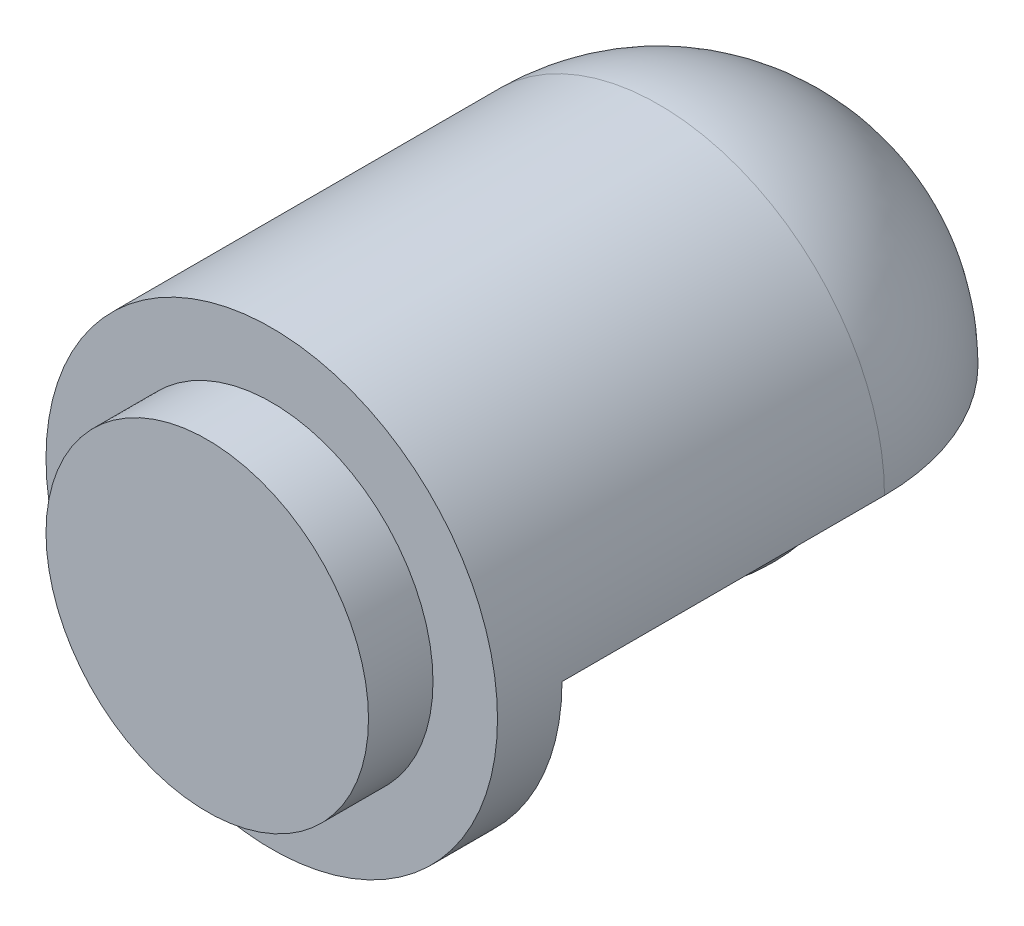
from build123d import *

# Parameters (mm, degrees)
SKETCH2_W           = 70
SKETCH2_H           = 120
REVOLVE2_ANGLE      = 180
SKETCH3_R           = 50
BOSS_EXTRUDE1_DEPTH = 20
SKETCH4_R           = 70
BOSS_EXTRUDE2_DEPTH = 20


with BuildPart() as part:
    # Sketch1 → Revolve1 (revolve)
    with BuildSketch(Plane(origin=(0, 0, 0), x_dir=(1, 0, 0), z_dir=(0, 1, 0))):
        with BuildLine():
            Line((0, 50), (0, -50))
            ThreePointArc((0, -50), (-50, 0), (0, 50))
        make_face()
    revolve(axis=Axis((0, 0, -50), (0, 0, 1)))

    # Sketch2 → Revolve2 (revolve)
    with BuildSketch(Plane(origin=(0, 0, 0), x_dir=(1, 0, 0), z_dir=(0, 1, 0))):
        with BuildLine():
            Line((0, 0), (0, 70))
            ThreePointArc((0, 70), (-49.497474683, 49.497474683), (-70, 0))
            Line((-70, 0), (0, 0))
        make_face()
        with Locations((-35, -60)):
            Rectangle(SKETCH2_W, SKETCH2_H)
    revolve(axis=Axis((0, 0, -70), (0, 0, -1)), revolution_arc=REVOLVE2_ANGLE)

    # Sketch3 → Boss-Extrude1 (add)
    with BuildSketch(Plane.XY.offset(120)):
        Circle(SKETCH3_R)
    extrude(amount=BOSS_EXTRUDE1_DEPTH)

    # Sketch4 → Boss-Extrude2 (add)
    with BuildSketch(Plane.XY.offset(120)):
        Circle(SKETCH4_R)
    extrude(amount=-BOSS_EXTRUDE2_DEPTH)


solid = part.part
